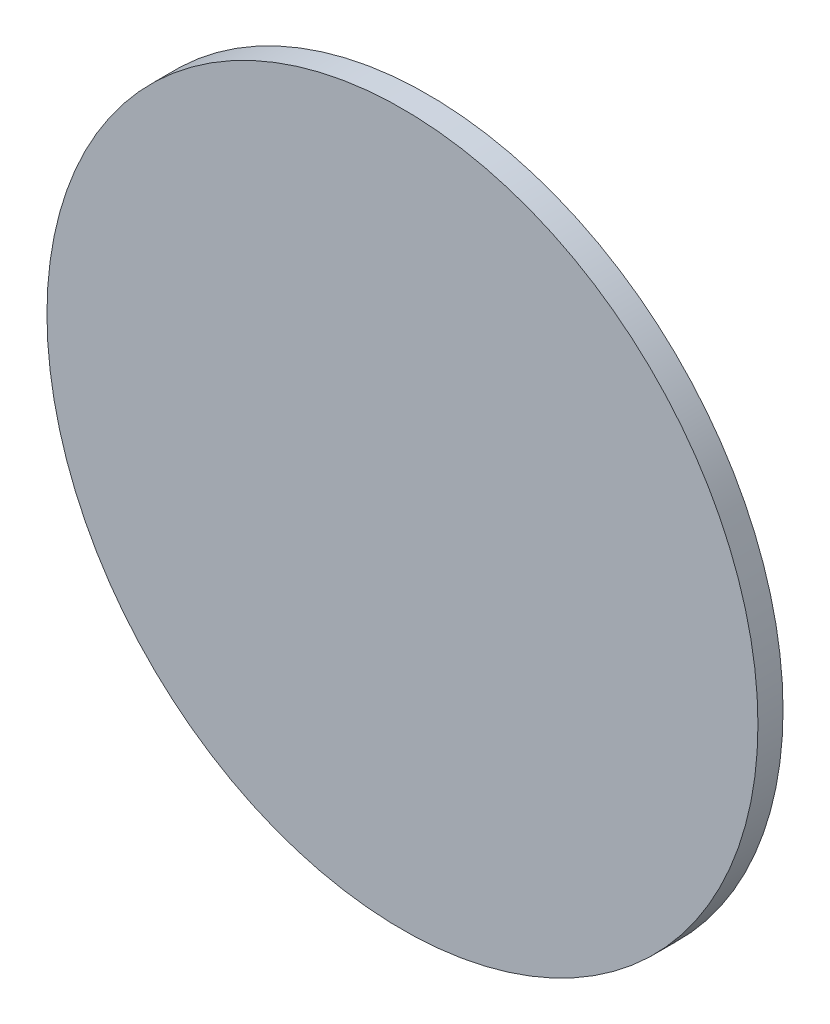
from build123d import *

# Parameters (mm, degrees)
SKETCH_1_R      = 42.5
EXTRUDE_1_DEPTH = 3


with BuildPart() as part:
    # 草图1 → 凸台-拉伸1 (new body)
    with BuildSketch(Plane.XY):
        Circle(SKETCH_1_R)
    extrude(amount=EXTRUDE_1_DEPTH)


solid = part.part
